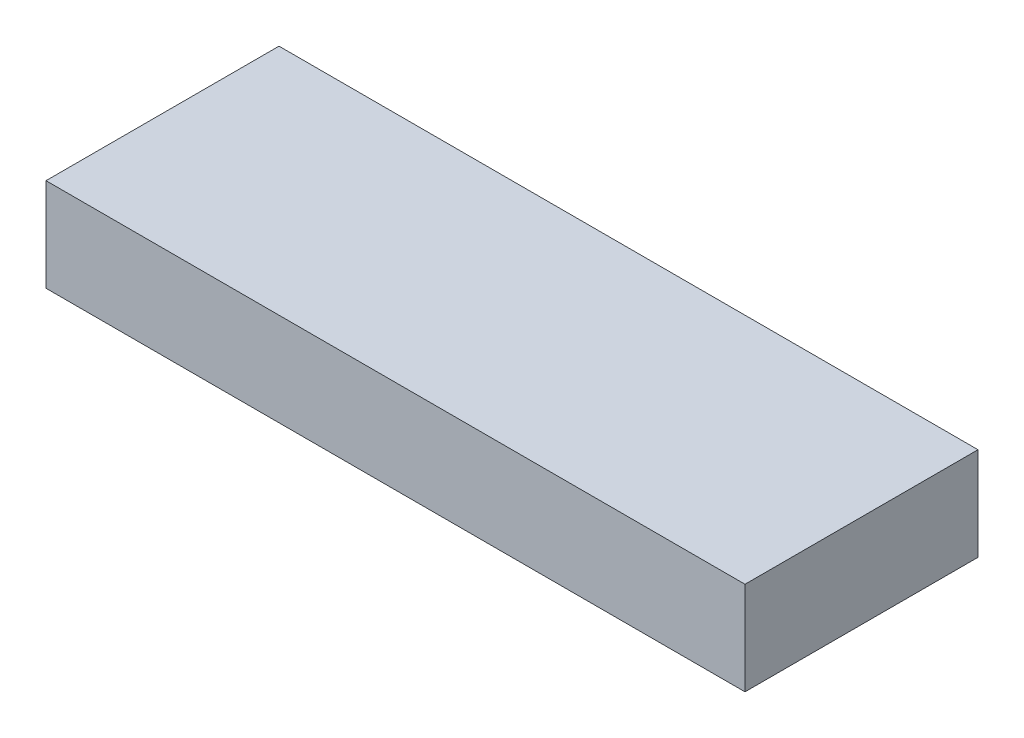
from build123d import *

# Parameters (mm, degrees)
SKETCH1_W           = 150
SKETCH1_H           = 20
BOSS_EXTRUDE1_DEPTH = 50


with BuildPart() as part:
    # Sketch1 → Boss-Extrude1 (new body)
    with BuildSketch(Plane.XY):
        with Locations((105, 0)):
            Rectangle(SKETCH1_W, SKETCH1_H)
    extrude(amount=BOSS_EXTRUDE1_DEPTH)


solid = part.part
